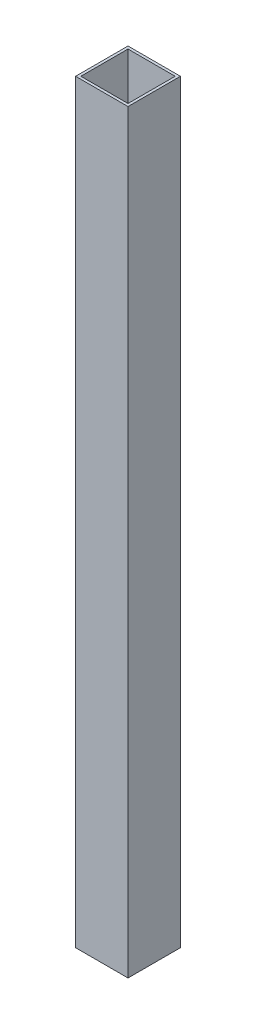
from build123d import *

# Parameters (mm, degrees)
SKETCH1_W           = 25
SKETCH1_H           = 25
SKETCH1_W_2         = 22.500853306
SKETCH1_H_2         = 22.500853306
BOSS_EXTRUDE1_DEPTH = 360


with BuildPart() as part:
    # Sketch1 → Boss-Extrude1 (new body)
    with BuildSketch(Plane(origin=(0, 0, 0), x_dir=(1, 0, 0), z_dir=(0, 1, 0))):
        Rectangle(SKETCH1_W, SKETCH1_H)
        Rectangle(SKETCH1_W_2, SKETCH1_H_2, mode=Mode.SUBTRACT)
    extrude(amount=BOSS_EXTRUDE1_DEPTH)


solid = part.part
